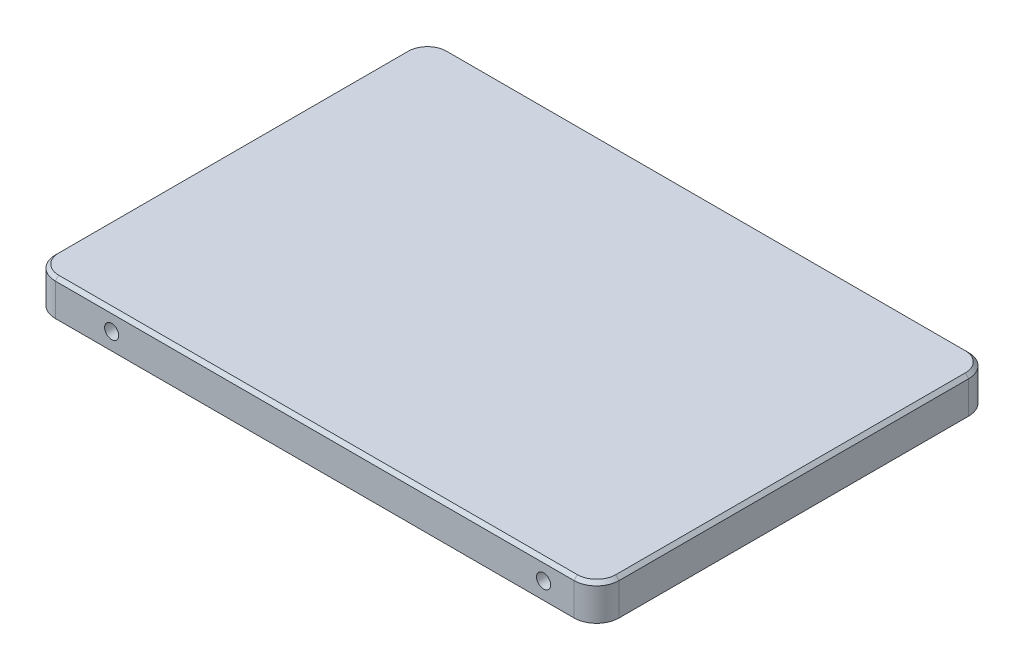
from build123d import *

# Parameters (mm, degrees)
BOSS_EXTRUDE1_DEPTH = 6.35
SKETCH2_W           = 5
SKETCH2_H           = 37.5
CUT_EXTRUDE1_DEPTH  = 5
SKETCH3_W           = 2
SKETCH3_H           = 2.75
CUT_EXTRUDE2_DEPTH  = 5
SKETCH4_W           = 20
SKETCH4_H           = 1
SKETCH4_W_2         = 9.5
BOSS_EXTRUDE2_DEPTH = 5
SKETCH5_R           = 1.25
CUT_EXTRUDE3_DEPTH  = 5
SKETCH6_R           = 1.25
CUT_EXTRUDE4_DEPTH  = 6
CHAMFER1_SIZE       = 0.6


with BuildPart() as part:
    # Sketch1 → Boss-Extrude1 (new body)
    with BuildSketch(Plane(origin=(0, 0, 0), x_dir=(1, 0, 0), z_dir=(0, 1, 0))):
        with BuildLine():
            Line((-46, -35), (46, -35))
            ThreePointArc((46, -35), (48.828427125, -33.828427125), (50, -31))
            Line((50, -31), (50, 31))
            ThreePointArc((50, 31), (48.828427125, 33.828427125), (46, 35))
            Line((46, 35), (-46, 35))
            ThreePointArc((-46, 35), (-48.828427125, 33.828427125), (-50, 31))
            Line((-50, 31), (-50, -31))
            ThreePointArc((-50, -31), (-48.828427125, -33.828427125), (-46, -35))
        make_face()
    extrude(amount=BOSS_EXTRUDE1_DEPTH)

    # Sketch2 → Cut-Extrude1 (cut)
    with BuildSketch(Plane.XZ):
        with Locations((-47.5, -5.25)):
            Rectangle(SKETCH2_W, SKETCH2_H)
    extrude(amount=-CUT_EXTRUDE1_DEPTH, mode=Mode.SUBTRACT)

    # Sketch3 → Cut-Extrude2 (cut)
    with BuildSketch(Plane.ZY.offset(50)):
        with Locations((-25, 1.975)):
            Rectangle(SKETCH3_W, SKETCH3_H)
        with Locations((14.5, 1.975)):
            Rectangle(SKETCH3_W, SKETCH3_H)
    extrude(amount=-CUT_EXTRUDE2_DEPTH, mode=Mode.SUBTRACT)

    # Sketch4 → Boss-Extrude2 (add)
    with BuildSketch(Plane.ZY.offset(45)):
        with Locations((-12, 2.5)):
            Rectangle(SKETCH4_W, SKETCH4_H)
        Polygon((-1, 3), (-2, 3), (-2, 2), (-2, 1.25), (-1, 1.25), align=None)
        Polygon((2, 2), (2, 3), (1, 3), (1, 1.25), (2, 1.25), align=None)
        with Locations((6.75, 2.5)):
            Rectangle(SKETCH4_W_2, SKETCH4_H)
    extrude(amount=BOSS_EXTRUDE2_DEPTH)

    # Sketch5 → Cut-Extrude3 (cut)
    with BuildSketch(Plane.XZ):
        with Locations(Location((-36, 30.86, 0), (0, 0, 270))):
            Circle(SKETCH5_R)
        with Locations(Location((40.6, 30.86, 0), (0, 0, 270))):
            Circle(SKETCH5_R)
        with Locations(Location((40.6, -30.86, 0), (0, 0, 270))):
            Circle(SKETCH5_R)
        with Locations(Location((-36, -30.86, 0), (0, 0, 270))):
            Circle(SKETCH5_R)
    extrude(amount=-CUT_EXTRUDE3_DEPTH, mode=Mode.SUBTRACT)

    # Sketch6 → Cut-Extrude4 (cut)
    with BuildSketch(Plane(origin=(0, 0, -35), x_dir=(-1, 0, 0), z_dir=(0, 0, -1))):
        with Locations((-40.6, 3)):
            Circle(SKETCH6_R)
        with Locations((36, 3)):
            Circle(SKETCH6_R)
    cut_extrude4 = extrude(amount=-CUT_EXTRUDE4_DEPTH, mode=Mode.SUBTRACT)

    # Mirror1: Cut-Extrude4 across plane
    add(cut_extrude4.mirror(Plane.XY), mode=Mode.SUBTRACT)

    # Chamfer1
    chamfer1_edges = [part.edges().sort_by_distance(p)[0] for p in [
        (48.828427125, 6.35, 33.828427125),
        (50, 6.35, 0),
        (48.828427125, 6.35, -33.828427125),
        (0, 6.35, -35),
        (-48.828427125, 6.35, -33.828427125),
        (-50, 6.35, 0),
        (-48.828427125, 6.35, 33.828427125),
        (0, 6.35, 35),
    ]]
    chamfer(chamfer1_edges, length=CHAMFER1_SIZE)


solid = part.part
